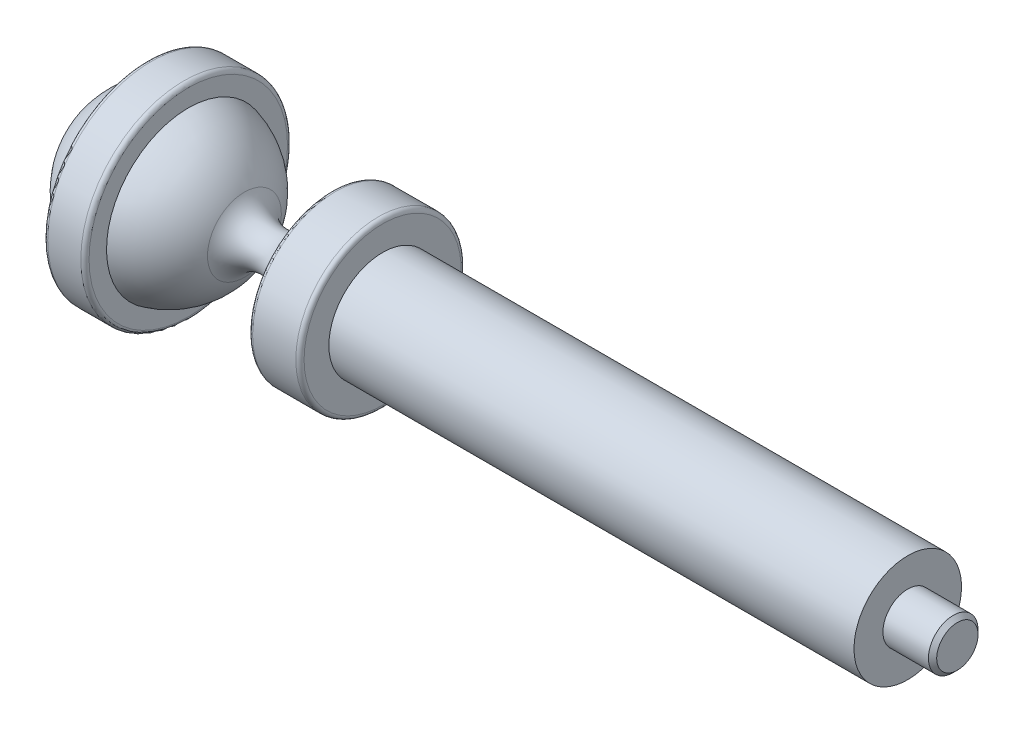
from build123d import *

# Parameters (mm, degrees)
FILLET1_R = 0.5


with BuildPart() as part:
    # Sketch1 → Revolve1 (revolve)
    with BuildSketch(Plane.XY, mode=Mode.PRIVATE) as revolve1_sk:
        with BuildLine():
            Line((0, 0), (105.5, 0))
            Line((105.5, 0), (105.5, 2.5))
            Line((105.5, 2.5), (105, 3))
            Line((105, 3), (99.5, 3))
            Line((99.5, 3), (99.5, 6.5))
            Line((99.5, 6.5), (36, 6.5))
            Line((36, 6.5), (36, 10))
            Line((36, 10), (30, 10))
            Line((30, 10), (26.261285599, 4.084478618))
            ThreePointArc((26.261285599, 4.084478618), (22.662646852, 2.227420735), (19.286779661, 4.464022068))
            ThreePointArc((19.286779661, 4.464022068), (16.502204007, 7.937382965), (12.5, 9.886859967))
            Line((12.5, 9.886859967), (12.5, 12.5))
            Line((12.5, 12.5), (7.5, 12.5))
            Line((7.5, 12.5), (7.5, 9.805610639))
            ThreePointArc((7.5, 9.805610639), (2.08995663, 6.172519745), (0, 0))
        make_face()
    revolve(revolve1_sk.sketch.rotate(Axis((0, 0, 0), (1, 0, 0)), 90), axis=Axis((0, 0, 0), (1, 0, 0)))

    # Fillet1
    fillet1_edges = [part.edges().sort_by_distance(p)[0] for p in [
        (7.5, 0, -12.5),
        (12.5, 0, -12.5),
        (30, 0, -10),
        (36, 0, -10),
    ]]
    fillet(fillet1_edges, radius=FILLET1_R)


solid = part.part
